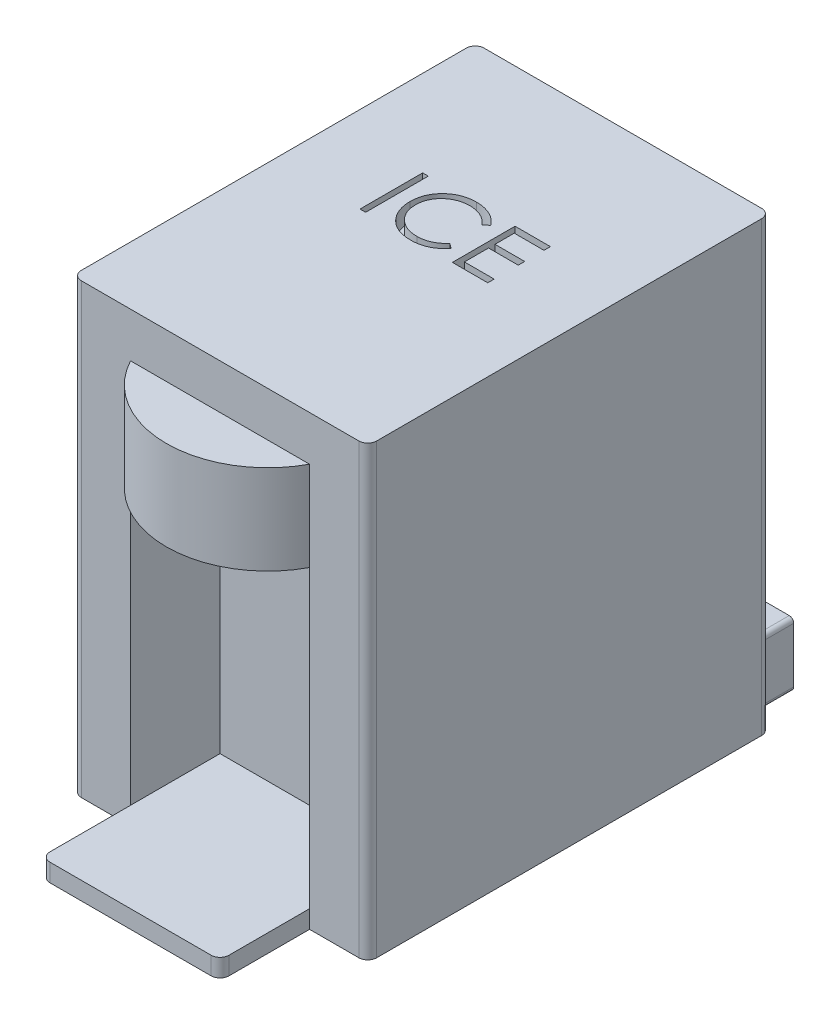
from build123d import *

# Parameters (mm, degrees)
SKETCH1_W           = 330
SKETCH1_H           = 450
BOSS_EXTRUDE1_DEPTH = 500
SKETCH2_W           = 200
SKETCH2_H           = 350
CUT_EXTRUDE1_DEPTH  = 100
BOSS_EXTRUDE2_DEPTH = 100
SKETCH4_W           = 200
SKETCH4_H           = 20
BOSS_EXTRUDE3_DEPTH = 200
SKETCH5_R           = 58.984993577
CUT_EXTRUDE2_DEPTH  = 50
FILLET1_R           = 10
SKETCH6_W           = 108.793875533
SKETCH6_H           = 71.48855694
BOSS_EXTRUDE4_DEPTH = 50
FILLET2_R           = 5
FILLET3_R           = 10
SKETCH7_W           = 6.282051282
SKETCH7_H           = 70
CUT_EXTRUDE3_DEPTH  = 20


with BuildPart() as part:
    # Sketch1 → Boss-Extrude1 (new body)
    with BuildSketch(Plane(origin=(0, 0, 0), x_dir=(1, 0, 0), z_dir=(0, 1, 0))):
        Rectangle(SKETCH1_W, SKETCH1_H)
    extrude(amount=BOSS_EXTRUDE1_DEPTH)

    # Sketch2 → Cut-Extrude1 (cut)
    with BuildSketch(Plane.XY.offset(225)):
        with Locations((0, 175)):
            Rectangle(SKETCH2_W, SKETCH2_H)
    extrude(amount=-CUT_EXTRUDE1_DEPTH, mode=Mode.SUBTRACT)

    # Sketch3 → Boss-Extrude2 (add)
    with BuildSketch(Plane.XZ.offset(-350)):
        with BuildLine():
            Line((100, 225), (-100, 225))
            ThreePointArc((-100, 225), (0, 284.9775435), (100, 225))
        make_face()
    extrude(amount=-BOSS_EXTRUDE2_DEPTH)

    # Sketch4 → Boss-Extrude3 (add)
    with BuildSketch(Plane.XY.offset(125)):
        with Locations((0, 10)):
            Rectangle(SKETCH4_W, SKETCH4_H)
    extrude(amount=BOSS_EXTRUDE3_DEPTH)

    # Sketch5 → Cut-Extrude2 (cut)
    with BuildSketch(Plane.XZ.offset(-350)):
        with Locations((0, 203.171289973)):
            Circle(SKETCH5_R)
    extrude(amount=-CUT_EXTRUDE2_DEPTH, mode=Mode.SUBTRACT)

    # Fillet1
    fillet1_edges = [part.edges().sort_by_distance(p)[0] for p in [
        (165, 250, 225),
        (-165, 250, 225),
        (-165, 250, -225),
        (165, 250, -225),
    ]]
    fillet(fillet1_edges, radius=FILLET1_R)

    # Sketch6 → Boss-Extrude4 (add)
    with BuildSketch(Plane(origin=(0, 0, -225), x_dir=(-1, 0, 0), z_dir=(0, 0, -1))):
        with Locations((-86.447180312, 35.74427847)):
            Rectangle(SKETCH6_W, SKETCH6_H)
    extrude(amount=BOSS_EXTRUDE4_DEPTH)

    # Fillet2
    fillet2_edges = [part.edges().sort_by_distance(p)[0] for p in [
        (140.844118078, 71.48855694, -250),
        (140.844118078, 0, -250),
        (32.050242545, 0, -250),
        (32.050242545, 71.48855694, -250),
    ]]
    fillet(fillet2_edges, radius=FILLET2_R)

    # Fillet3
    fillet3_edges = [part.edges().sort_by_distance(p)[0] for p in [
        (-100, 10, 325),
        (100, 10, 325),
    ]]
    fillet(fillet3_edges, radius=FILLET3_R)

    # Sketch7 → Cut-Extrude3 (cut)
    with BuildSketch(Plane(origin=(0, 500, 0), x_dir=(1, 0, 0), z_dir=(0, 1, 0))):
        with Locations((-65.512820513, 35)):
            Rectangle(SKETCH7_W, SKETCH7_H)
        with BuildLine():
            Line((20.192307692, 57.155448718), (14.695512821, 52.948717949))
            add(Edge.make_bspline(
                [(14.695512821, 52.948717949), (14.303395053, 53.416037345), (13.524446117, 54.34437566), (12.271262066, 55.647966549), (10.965229208, 56.869271778), (9.606846784, 58.01410937), (8.171664394, 59.042444685), (6.694448421, 60.007866744), (5.150487517, 60.873221503), (3.015452824, 61.922481225), (0.222495858, 63.017404325), (-3.293400923, 63.935468951), (-6.963622893, 64.519892465), (-9.467574885, 64.583189294), (-10.741185897, 64.615384615)],
                knots=[0, 0, 0, 0, 0.757959112, 1.505699292, 2.245454638, 2.979532153, 3.711538275, 4.438200793, 5.171680507, 5.909471876, 7.393775596, 8.890124382, 10.418191784, 12, 12, 12, 12], degree=3))
            add(Edge.make_bspline(
                [(-10.741185897, 64.615384615), (-11.442851884, 64.607305365), (-12.839671736, 64.591221848), (-14.912641206, 64.379039344), (-16.946902228, 64.080815143), (-18.941131553, 63.638308678), (-20.892790723, 63.078856297), (-22.814638765, 62.410348018), (-24.678850761, 61.583251221), (-26.511215525, 60.669086022), (-28.266799745, 59.636537127), (-29.9279007, 58.51027009), (-31.488460059, 57.302888161), (-32.949712302, 56.009866033), (-34.313151268, 54.637026824), (-35.568897484, 53.169739992), (-36.71260569, 51.612696522), (-37.766946191, 49.98642837), (-38.711200858, 48.295672538), (-39.501798446, 46.534171129), (-40.20190089, 44.732089068), (-40.755885743, 42.869065852), (-41.194376079, 40.958210535), (-41.496929345, 38.994394776), (-41.706698769, 36.981721184), (-41.722702307, 35.617534932), (-41.730769231, 34.929887821)],
                knots=[0, 0, 0, 0, 1.054917814, 2.100044995, 3.131103042, 4.146048494, 5.169673617, 6.183595914, 7.203665975, 8.234915748, 9.262203917, 10.264457458, 11.251630812, 12.227803204, 13.197192746, 14.159520551, 15.12972552, 16.100847026, 17.073214652, 18.039054194, 19.002613845, 19.979014051, 20.95965708, 21.949030935, 22.966165397, 24, 24, 24, 24], degree=3))
            add(Edge.make_bspline(
                [(-41.730769231, 34.929887821), (-41.70553285, 33.895261422), (-41.655984565, 31.863909725), (-41.215017883, 28.888497514), (-40.544916057, 26.038084039), (-39.540604519, 23.330487192), (-38.302223507, 20.732320031), (-36.737411277, 18.287542963), (-34.92508053, 15.959211673), (-32.839592141, 13.802352718), (-30.551475821, 11.832078212), (-28.096517589, 10.097066582), (-25.480831833, 8.650768932), (-22.73329923, 7.447250002), (-19.832776951, 6.522115449), (-16.784480903, 5.870832979), (-13.595040998, 5.445989368), (-11.415653, 5.405315607), (-10.306490385, 5.384615385)],
                knots=[0, 0, 0, 0, 1.029171465, 2.020641659, 2.987623507, 3.938342917, 4.889210282, 5.84687017, 6.821220943, 7.821438502, 8.827599549, 9.822697543, 10.807740252, 11.797342354, 12.80366471, 13.83203677, 14.896651826, 16, 16, 16, 16], degree=3))
            add(Edge.make_bspline(
                [(-10.306490385, 5.384615385), (-9.084436605, 5.41839098), (-6.679142426, 5.48486943), (-3.1517819, 6.048054413), (0.224933413, 6.96121277), (3.451185144, 8.239171216), (6.517878068, 9.900476974), (9.429811274, 11.914434522), (12.189442684, 14.300201177), (13.848868329, 16.121863743), (14.695512821, 17.051282051)],
                knots=[0, 0, 0, 0, 1.028121516, 2.023589091, 2.998037872, 3.967518031, 4.937445131, 5.927275754, 6.942489185, 8, 8, 8, 8], degree=3))
            Line((14.695512821, 17.051282051), (20.192307692, 12.88661859))
            add(Edge.make_bspline(
                [(20.192307692, 12.88661859), (19.749945495, 12.315849551), (18.867339989, 11.177045426), (17.43817965, 9.571611231), (15.932633702, 8.061530521), (14.339519502, 6.658978097), (12.67716367, 5.335888785), (10.915717423, 4.129852159), (9.078336773, 3.024034474), (7.171247195, 2.011495983), (5.196474939, 1.113151043), (3.15638624, 0.344075687), (1.05977473, -0.318422104), (-1.093455438, -0.863460838), (-3.307770575, -1.288882516), (-5.575180057, -1.573276013), (-7.900577561, -1.768114301), (-9.469405984, -1.785872618), (-10.264423077, -1.794871795)],
                knots=[0, 0, 0, 0, 0.986787822, 1.968848986, 2.935600012, 3.899624008, 4.868462664, 5.837806735, 6.815139263, 7.798259679, 8.787526145, 9.778297419, 10.776456485, 11.791383307, 12.812564526, 13.85620153, 14.913611965, 16, 16, 16, 16], degree=3))
            add(Edge.make_bspline(
                [(-10.264423077, -1.794871795), (-11.017296418, -1.789631944), (-12.50601022, -1.779270787), (-14.703985252, -1.611427439), (-16.843776868, -1.382432701), (-18.919269386, -1.037630079), (-20.941788887, -0.630743278), (-22.893000576, -0.085318146), (-24.792104784, 0.525665186), (-26.631471597, 1.243764921), (-28.412665593, 2.054088572), (-30.129941821, 2.96991975), (-31.782510469, 3.983557043), (-33.386618886, 5.072657252), (-34.918570559, 6.272203289), (-36.391641066, 7.565535979), (-37.814090591, 8.948296194), (-38.694144291, 9.945393261), (-39.13661859, 10.446714744)],
                knots=[0, 0, 0, 0, 1.114604814, 2.203992996, 3.262667896, 4.300477797, 5.318619304, 6.316056647, 7.298880507, 8.271930387, 9.238335007, 10.195173496, 11.151986948, 12.108099108, 13.064862484, 14.031167946, 15.010108607, 16, 16, 16, 16], degree=3))
            add(Edge.make_bspline(
                [(-39.13661859, 10.446714744), (-39.84533146, 11.317538522), (-41.254200996, 13.04867273), (-43.056714667, 15.854392355), (-44.599665772, 18.783756533), (-45.847184187, 21.852155108), (-46.82243885, 25.052702853), (-47.498062752, 28.387013141), (-47.937094841, 31.851971985), (-47.987300617, 34.208707759), (-48.012820513, 35.406650641)],
                knots=[0, 0, 0, 0, 0.994628077, 1.977248131, 2.950237994, 3.925870899, 4.908910175, 5.911660606, 6.938484602, 8, 8, 8, 8], degree=3))
            add(Edge.make_bspline(
                [(-48.012820513, 35.406650641), (-47.981716642, 36.665759712), (-47.920521717, 39.142978203), (-47.400605808, 42.778457269), (-46.564229884, 46.261485246), (-45.376292112, 49.585560138), (-43.870185086, 52.768165742), (-42.009652809, 55.784989839), (-39.816309965, 58.655325832), (-37.307358611, 61.335620858), (-34.556011905, 63.786407911), (-31.609635627, 65.942531986), (-28.473996688, 67.736882306), (-25.183639654, 69.236805554), (-21.713926023, 70.389694817), (-18.07225864, 71.196758551), (-14.265480345, 71.699100877), (-11.668231832, 71.762605035), (-10.348557692, 71.794871795)],
                knots=[0, 0, 0, 0, 1.032925535, 2.032216505, 3.007276963, 3.968222605, 4.92396291, 5.891752235, 6.871517503, 7.883894988, 8.900124299, 9.891468569, 10.874487609, 11.85992873, 12.854644235, 13.869047385, 14.917252991, 16, 16, 16, 16], degree=3))
            add(Edge.make_bspline(
                [(-10.348557692, 71.794871795), (-9.544268253, 71.785229031), (-7.952258307, 71.766142151), (-5.597205259, 71.580019309), (-3.30435872, 71.269747184), (-1.07213908, 70.847425788), (1.110313244, 70.323279359), (3.226318062, 69.640473392), (5.288291799, 68.859742766), (7.283229963, 67.960573447), (9.201560966, 66.951238619), (11.042687336, 65.842926148), (12.79198451, 64.637010038), (14.461761479, 63.34374653), (16.0240857, 61.935775344), (17.523315271, 60.451823425), (18.908536834, 58.849146941), (19.763600734, 57.721048263), (20.192307692, 57.155448718)],
                knots=[0, 0, 0, 0, 1.096760587, 2.17092713, 3.219439832, 4.250915756, 5.268269357, 6.278326846, 7.281116186, 8.274029601, 9.260640565, 10.235837813, 11.203064059, 12.156899882, 13.114053108, 14.069676657, 15.032185724, 16, 16, 16, 16], degree=3))
        make_face()
        Polygon((34.551282051, 70), (74.038461538, 70), (74.038461538, 62.820512821), (40.833333333, 62.820512821), (40.833333333, 41.282051282), (74.038461538, 41.282051282), (74.038461538, 34.102564103), (40.833333333, 34.102564103), (40.833333333, 7.179487179), (74.038461538, 7.179487179), (74.038461538, 0), (34.551282051, 0), align=None)
    extrude(amount=-CUT_EXTRUDE3_DEPTH, mode=Mode.SUBTRACT)


solid = part.part
